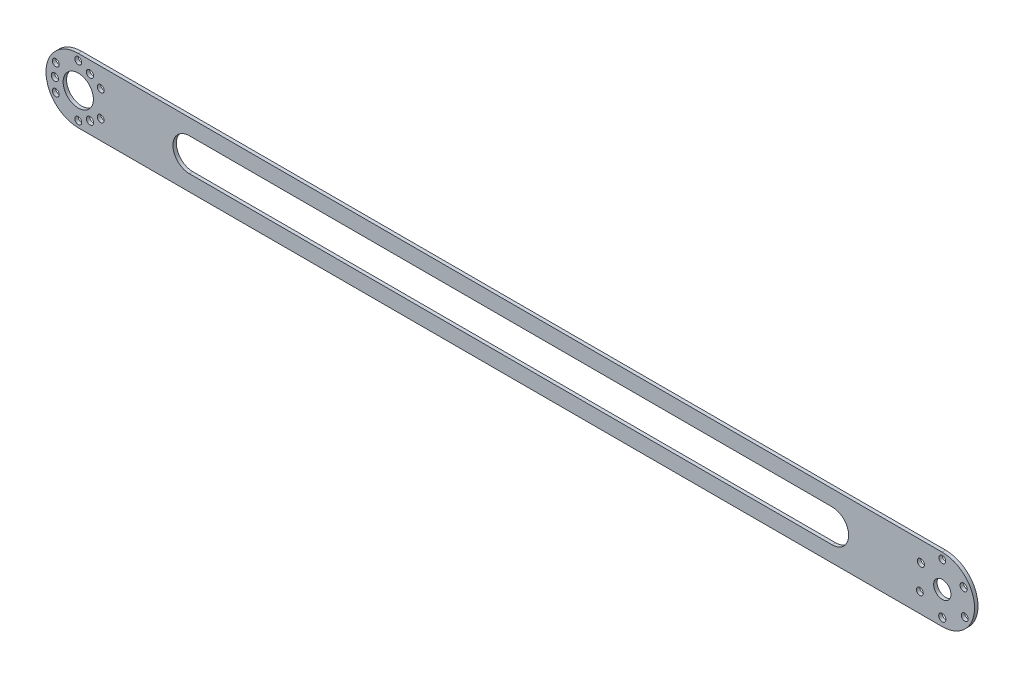
from build123d import *

# Parameters (mm, degrees)
SKETCH_1_R      = 5
SKETCH_1_R_2    = 2
SKETCH_1_R_3    = 2.08
SKETCH_1_R_4    = 8.75
EXTRUDE_1_DEPTH = 2


with BuildPart() as part:
    # 草图1 → 凸台-拉伸1 (new body)
    with BuildSketch(Plane.XY):
        with BuildLine():
            Line((341.797136251, -66.261433116), (-157.620006606, -66.261433116))
            ThreePointArc((-157.620006606, -66.261433116), (-176.265720892, -84.907147401), (-157.620006606, -103.552861687))
            Line((-157.620006606, -103.552861687), (341.797136251, -103.552861687))
            ThreePointArc((341.797136251, -103.552861687), (360.442850537, -84.907147401), (341.797136251, -66.261433116))
        make_face()
        with Locations((341.797136251, -84.907147401)):
            Circle(SKETCH_1_R, mode=Mode.SUBTRACT)
        with Locations((341.797136251, -69.907147401)):
            Circle(SKETCH_1_R_2, mode=Mode.SUBTRACT)
        with Locations((354.787517308, -92.261433116)):
            Circle(SKETCH_1_R_2, mode=Mode.SUBTRACT)
        with Locations((328.806755195, -92.407147401)):
            Circle(SKETCH_1_R_2, mode=Mode.SUBTRACT)
        with Locations((329.434548711, -77.769604157)):
            Circle(SKETCH_1_R_3, mode=Mode.SUBTRACT)
        with Locations((354.159723792, -77.623889871)):
            Circle(SKETCH_1_R_3, mode=Mode.SUBTRACT)
        with Locations((341.797136251, -99.036519604)):
            Circle(SKETCH_1_R_3, mode=Mode.SUBTRACT)
        with Locations((-157.620006606, -99.907147401)):
            Circle(SKETCH_1_R_2, mode=Mode.SUBTRACT)
        with Locations((-170.610387663, -92.407147401)):
            Circle(SKETCH_1_R_2, mode=Mode.SUBTRACT)
        with Locations((-170.610387663, -77.407147401)):
            Circle(SKETCH_1_R_2, mode=Mode.SUBTRACT)
        with Locations((-157.620006606, -69.907147401)):
            Circle(SKETCH_1_R_2, mode=Mode.SUBTRACT)
        with Locations((-144.629625549, -77.407147401)):
            Circle(SKETCH_1_R_2, mode=Mode.SUBTRACT)
        with Locations((-144.629625549, -92.407147401)):
            Circle(SKETCH_1_R_2, mode=Mode.SUBTRACT)
        with Locations((-171.150006606, -84.907147401)):
            Circle(SKETCH_1_R_3, mode=Mode.SUBTRACT)
        with Locations((-150.855006606, -73.189823688)):
            Circle(SKETCH_1_R_3, mode=Mode.SUBTRACT)
        with Locations((-150.855006606, -96.624471115)):
            Circle(SKETCH_1_R_3, mode=Mode.SUBTRACT)
        with Locations((-157.620006606, -84.907147401)):
            Circle(SKETCH_1_R_4, mode=Mode.SUBTRACT)
        with BuildLine():
            Line((-93.421962488, -75.424045387), (278.181949277, -75.424045387))
            ThreePointArc((278.181949277, -75.424045387), (287.665051291, -84.907147401), (278.181949277, -94.390249416))
            Line((278.181949277, -94.390249416), (-93.421962488, -94.390249416))
            ThreePointArc((-93.421962488, -94.390249416), (-102.905064503, -84.907147401), (-93.421962488, -75.424045387))
        make_face(mode=Mode.SUBTRACT)
    extrude(amount=EXTRUDE_1_DEPTH)


solid = part.part
